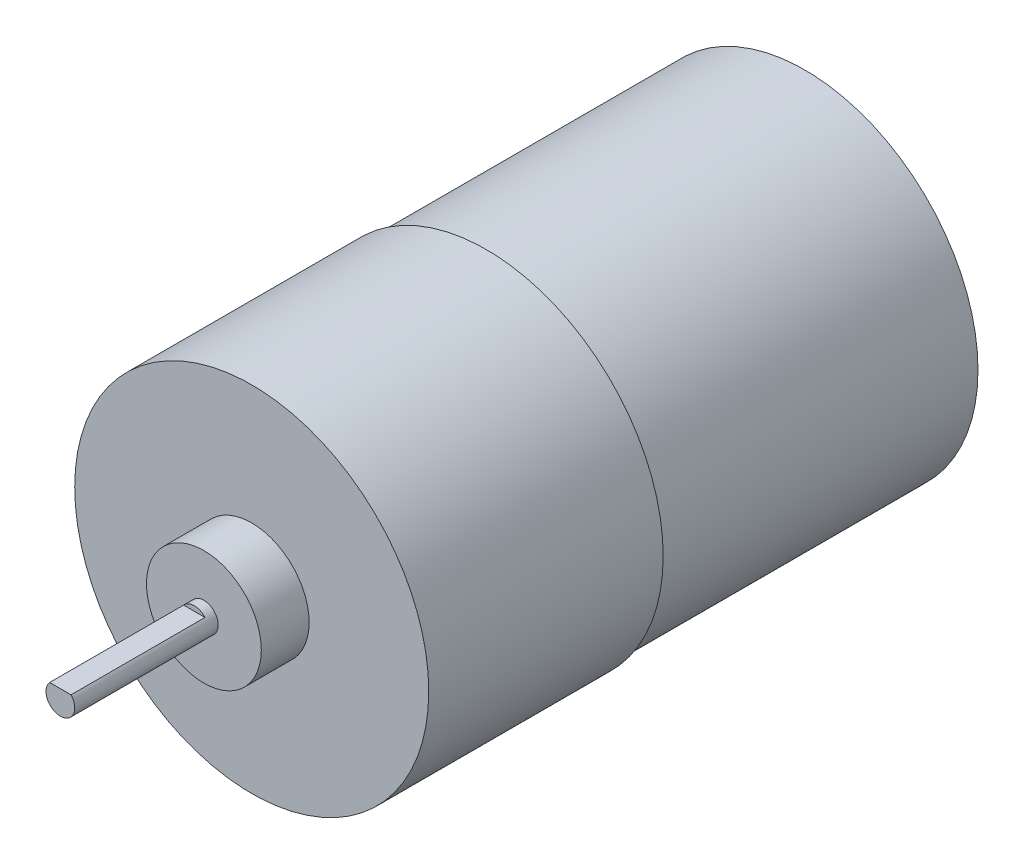
from build123d import *

# Parameters (mm, degrees)
SKETCH1_R           = 18.099999995
BOSS_EXTRUDE1_DEPTH = 33.3
SKETCH2_R           = 18.5
BOSS_EXTRUDE2_DEPTH = 24.5
SKETCH3_R           = 5.999999938
BOSS_EXTRUDE3_DEPTH = 5
SKETCH4_R           = 1.500000048
BOSS_EXTRUDE4_DEPTH = 15
CUT_EXTRUDE2_START  = -14
CUT_EXTRUDE2_DEPTH  = 14


with BuildPart() as part:
    # Sketch1 → Boss-Extrude1 (new body)
    with BuildSketch(Plane.XY):
        Circle(SKETCH1_R)
    extrude(amount=BOSS_EXTRUDE1_DEPTH)

    # Sketch2 → Boss-Extrude2 (add)
    with BuildSketch(Plane.XY.offset(33.3)):
        Circle(SKETCH2_R)
    extrude(amount=BOSS_EXTRUDE2_DEPTH)

    # Sketch3 → Boss-Extrude3 (add)
    with BuildSketch(Plane.XY.offset(57.8)):
        Circle(SKETCH3_R)
    extrude(amount=BOSS_EXTRUDE3_DEPTH)

    # Sketch4 → Boss-Extrude4 (add)
    with BuildSketch(Plane.XY.offset(62.8)):
        Circle(SKETCH4_R)
    extrude(amount=BOSS_EXTRUDE4_DEPTH)

    # Sketch8 → Cut-Extrude2 (cut)
    with BuildSketch(Plane.XY.offset(77.8).offset(CUT_EXTRUDE2_START)):
        with BuildLine():
            Line((-1.118034025, 1.000000032), (1.118034025, 1.000000032))
            ThreePointArc((1.118034025, 1.000000032), (0, 1.500000048), (-1.118034025, 1.000000032))
        make_face()
    extrude(amount=CUT_EXTRUDE2_DEPTH, mode=Mode.SUBTRACT)


solid = part.part
